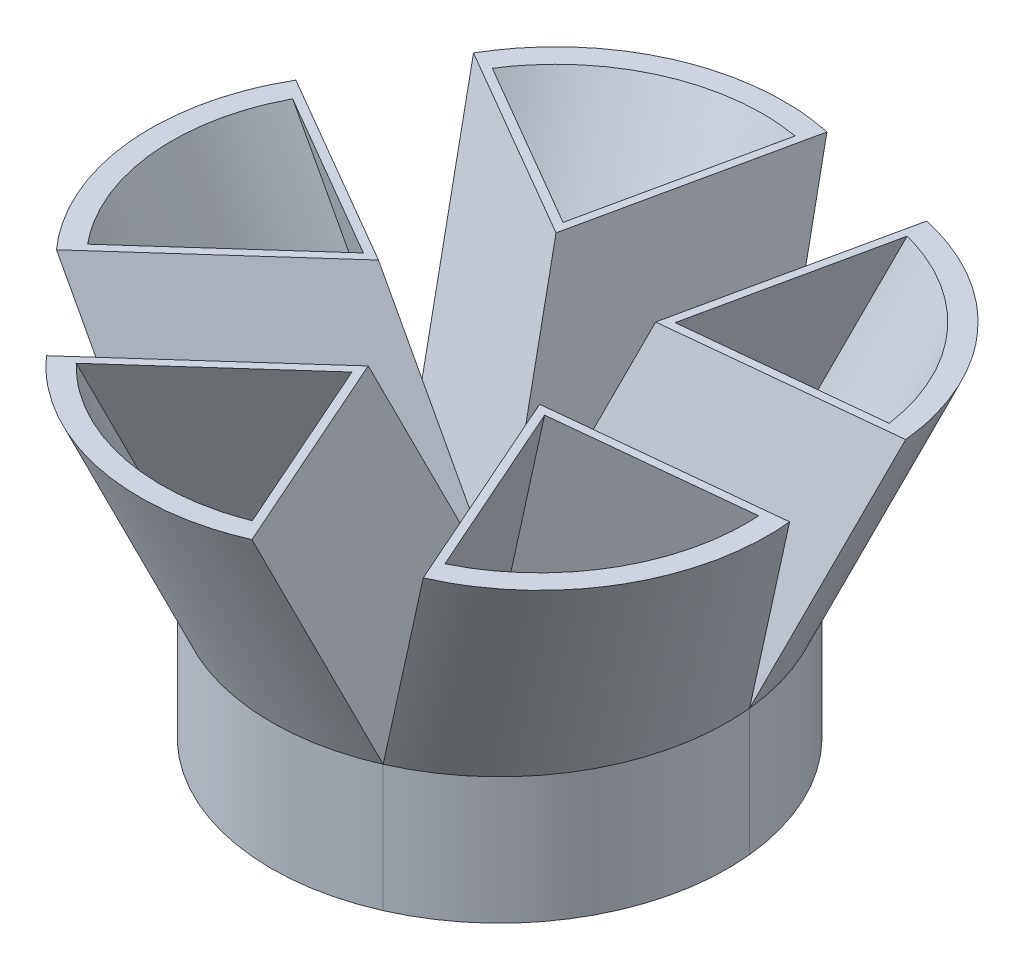
from build123d import *

# Parameters (mm, degrees)
BOSS_EXTRUDE1_DEPTH = 20
BOSS_EXTRUDE2_REACH = 128.869
CIRPATTERN1_COUNT   = 5
SKETCH5_W           = 180.779020629
SKETCH5_H           = 221.21381005
CUT_EXTRUDE1_DEPTH  = 95.689142857


with BuildPart() as part:
    # Sketch1 → Boss-Extrude1 (new body)
    with BuildSketch(Plane(origin=(0, 0, 0), x_dir=(1, 0, 0), z_dir=(0, 1, 0))):
        with BuildLine():
            Line((0, 0), (-26.793822286, -23.986144202))
            ThreePointArc((-26.793822286, -23.986144202), (-7.577955752, -35.154211881), (14.532432314, -32.894565469))
            Line((14.532432314, -32.894565469), (0, 0))
        make_face()
        with BuildLine():
            Line((-0.456697225, -2.118622956), (-23.40666458, -22.663703107))
            ThreePointArc((-23.40666458, -22.663703107), (-6.865544258, -31.849327894), (11.990905198, -30.294117875))
            Line((11.990905198, -30.294117875), (-0.456697225, -2.118622956))
        make_face(mode=Mode.SUBTRACT)
    extrude(amount=BOSS_EXTRUDE1_DEPTH)

    # Boss-Extrude2: up to this plane
    boss_extrude2_end = Plane(origin=(-6.641185463, 67.586699078, 30.80852522), z_dir=(0.08905536417875298, -0.906307787036651, -0.4131287175538856))
    # Sketch4 → Boss-Extrude2 (add, up to the surface)
    with BuildSketch(Plane(origin=(0, 20, 0), x_dir=(1, 0, 0), z_dir=(0, 1, 0)), mode=Mode.PRIVATE) as boss_extrude2_sk1:
        with BuildLine():
            Line((14.532432314, -32.894565469), (0, 0))
            Line((0, 0), (-26.793822286, -23.986144202))
            ThreePointArc((-26.793822286, -23.986144202), (-7.577955752, -35.154211881), (14.532432314, -32.894565469))
        make_face()
        with BuildLine():
            Line((-0.456697225, -2.118622956), (-23.40666458, -22.663703107))
            ThreePointArc((-23.40666458, -22.663703107), (-6.865544258, -31.849327894), (11.990905198, -30.294117875))
            Line((11.990905198, -30.294117875), (-0.456697225, -2.118622956))
        make_face(mode=Mode.SUBTRACT)
    boss_extrude2_tool1 = split(extrude(boss_extrude2_sk1.sketch, amount=BOSS_EXTRUDE2_REACH, dir=(-0.089055364179, 0.906307787037, 0.413128717554), mode=Mode.PRIVATE), bisect_by=boss_extrude2_end, keep=Keep.BOTH, mode=Mode.PRIVATE)
    add(boss_extrude2_tool1.solids().sort_by_distance((6.765116, 20, 16.668663))[0])


with BuildPart() as cirpattern1_1:
    # CirPattern1: pattern copy
    add(part.part.rotate(Axis((0, 20, 0), (0, -1, 0)), 1 * 360 / CIRPATTERN1_COUNT))


with BuildPart() as cirpattern1_2:
    # CirPattern1: pattern copy
    add(part.part.rotate(Axis((0, 20, 0), (0, -1, 0)), 2 * 360 / CIRPATTERN1_COUNT))


with BuildPart() as cirpattern1_3:
    # CirPattern1: pattern copy
    add(part.part.rotate(Axis((0, 20, 0), (0, -1, 0)), 3 * 360 / CIRPATTERN1_COUNT))


with BuildPart() as cirpattern1_4:
    # CirPattern1: pattern copy
    add(part.part.rotate(Axis((0, 20, 0), (0, -1, 0)), 4 * 360 / CIRPATTERN1_COUNT))


with BuildPart() as cut_extrude1_tool:
    # Sketch5 → Cut-Extrude1 (new, through all)
    with BuildSketch(Plane(origin=(0, 57.384721563, 0), x_dir=(1, 0, 0), z_dir=(0, 1, 0))):
        with Locations((-14.750659077, -8.714038408)):
            Rectangle(SKETCH5_W, SKETCH5_H)
    extrude(amount=CUT_EXTRUDE1_DEPTH)


with BuildPart() as part_1:
    add(part.part)

    # Cut-Extrude1: cut by cut_extrude1_tool
    add(cut_extrude1_tool.part, mode=Mode.SUBTRACT)


with BuildPart() as cirpattern1_1_1:
    add(cirpattern1_1.part)

    # Cut-Extrude1: cut by cut_extrude1_tool
    add(cut_extrude1_tool.part, mode=Mode.SUBTRACT)


with BuildPart() as cirpattern1_2_1:
    add(cirpattern1_2.part)

    # Cut-Extrude1: cut by cut_extrude1_tool
    add(cut_extrude1_tool.part, mode=Mode.SUBTRACT)


with BuildPart() as cirpattern1_3_1:
    add(cirpattern1_3.part)

    # Cut-Extrude1: cut by cut_extrude1_tool
    add(cut_extrude1_tool.part, mode=Mode.SUBTRACT)


with BuildPart() as cirpattern1_4_1:
    add(cirpattern1_4.part)

    # Cut-Extrude1: cut by cut_extrude1_tool
    add(cut_extrude1_tool.part, mode=Mode.SUBTRACT)


solid = Compound([part_1.part, cirpattern1_1_1.part, cirpattern1_2_1.part, cirpattern1_3_1.part, cirpattern1_4_1.part])
